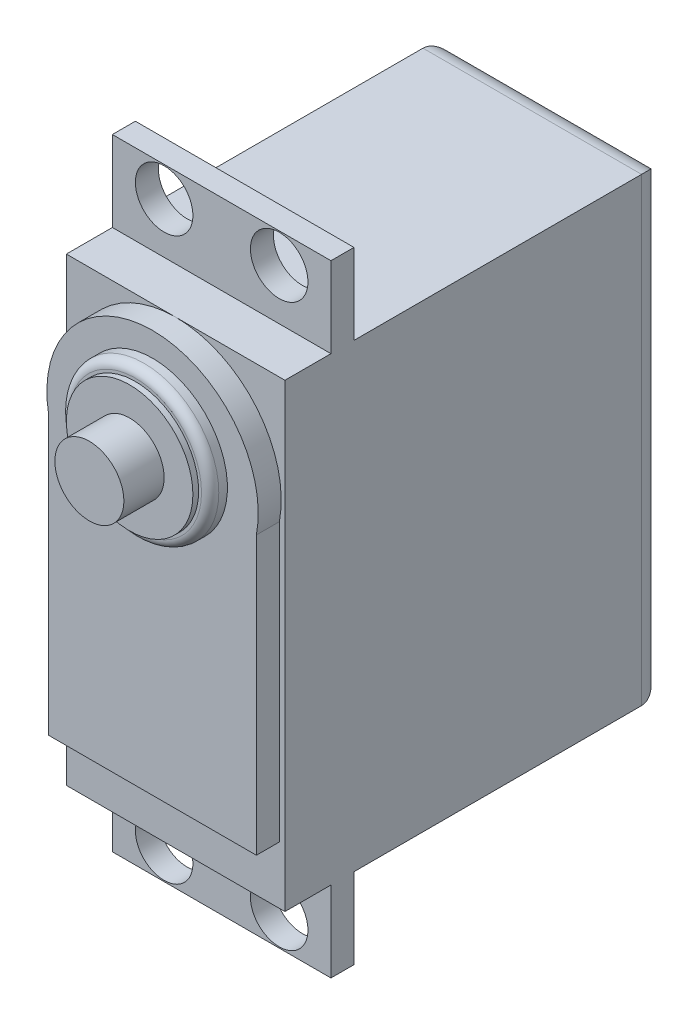
from build123d import *

# Parameters (mm, degrees)
BOSS_EXTRU_1_DEPTH       = 9.5
ESQUISSE3_R              = 2.5
ENL_V_MAT_EXTRU_40_DEPTH = 10
BOSS_EXTRU_2_DEPTH       = 2
CONG_1_R                 = 2
ESQUISSE5_R              = 6.5
BOSS_EXTRU_3_DEPTH       = 1.5
CONG_2_R                 = 0.75
ESQUISSE6_R              = 5.5
BOSS_EXTRU_4_DEPTH       = 0.5
ESQUISSE7_R              = 3
BOSS_EXTRU_5_DEPTH       = 3.5


with BuildPart() as part:
    # Esquisse1 → Boss.-Extru.1 (new, symmetric)
    with BuildSketch(Plane(origin=(0, 0, 0), x_dir=(0, 0, -1), z_dir=(1, 0, 0))):
        Polygon((0, 0), (4, 0), (4, -7), (6, -7), (6, 0), (33, 0), (33, 40), (6, 40), (6, 47), (4, 47), (4, 40), (0, 40), align=None)
    extrude(amount=BOSS_EXTRU_1_DEPTH, both=True)

    # Esquisse3 → Enlèv. mat.-Extru.40 (cut)
    with BuildSketch(Plane.XY.offset(-4)):
        with Locations((5, 44.4)):
            Circle(ESQUISSE3_R)
        with Locations((-5, 44.4)):
            Circle(ESQUISSE3_R)
        with Locations((5, -4.4)):
            Circle(ESQUISSE3_R)
        with Locations((-5, -4.4)):
            Circle(ESQUISSE3_R)
    extrude(amount=-ENL_V_MAT_EXTRU_40_DEPTH, mode=Mode.SUBTRACT)

    # Esquisse4 → Boss.-Extru.2 (add)
    with BuildSketch(Plane.XY):
        with BuildLine():
            Line((-9.034932354, 5), (9.018945802, 5))
            Line((9.018945802, 5), (9.018945802, 29.110938176))
            ThreePointArc((9.018945802, 29.110938176), (-0.007993276, 40), (-9.034932354, 29.110938176))
            Line((-9.034932354, 29.110938176), (-9.034932354, 5))
        make_face()
    extrude(amount=BOSS_EXTRU_2_DEPTH)

    # Congé1
    cong_1_edges = [part.edges().sort_by_distance(p)[0] for p in [
        (-9.5, 20, -33),
        (0, 40, -33),
        (0, 0, -33),
        (9.5, 20, -33),
    ]]
    fillet(cong_1_edges, radius=CONG_1_R)

    # Esquisse5 → Boss.-Extru.3 (add)
    with BuildSketch(Plane.XY.offset(2)):
        with Locations(Location((0, 31.4090745, 0), (0, 0, 180))):
            Circle(ESQUISSE5_R)
    extrude(amount=BOSS_EXTRU_3_DEPTH)

    # Congé2
    cong_2_edges = [part.edges().sort_by_distance(p)[0] for p in [
        (6.5, 31.4090745, 3.5),
    ]]
    fillet(cong_2_edges, radius=CONG_2_R)

    # Esquisse6 → Boss.-Extru.4 (add)
    with BuildSketch(Plane.XY.offset(3.5)):
        with Locations((0, 31.4090745)):
            Circle(ESQUISSE6_R)
    extrude(amount=BOSS_EXTRU_4_DEPTH)

    # Esquisse7 → Boss.-Extru.5 (add)
    with BuildSketch(Plane.XY.offset(4)):
        with Locations((0, 31.4090745)):
            Circle(ESQUISSE7_R)
    extrude(amount=BOSS_EXTRU_5_DEPTH)


solid = part.part
